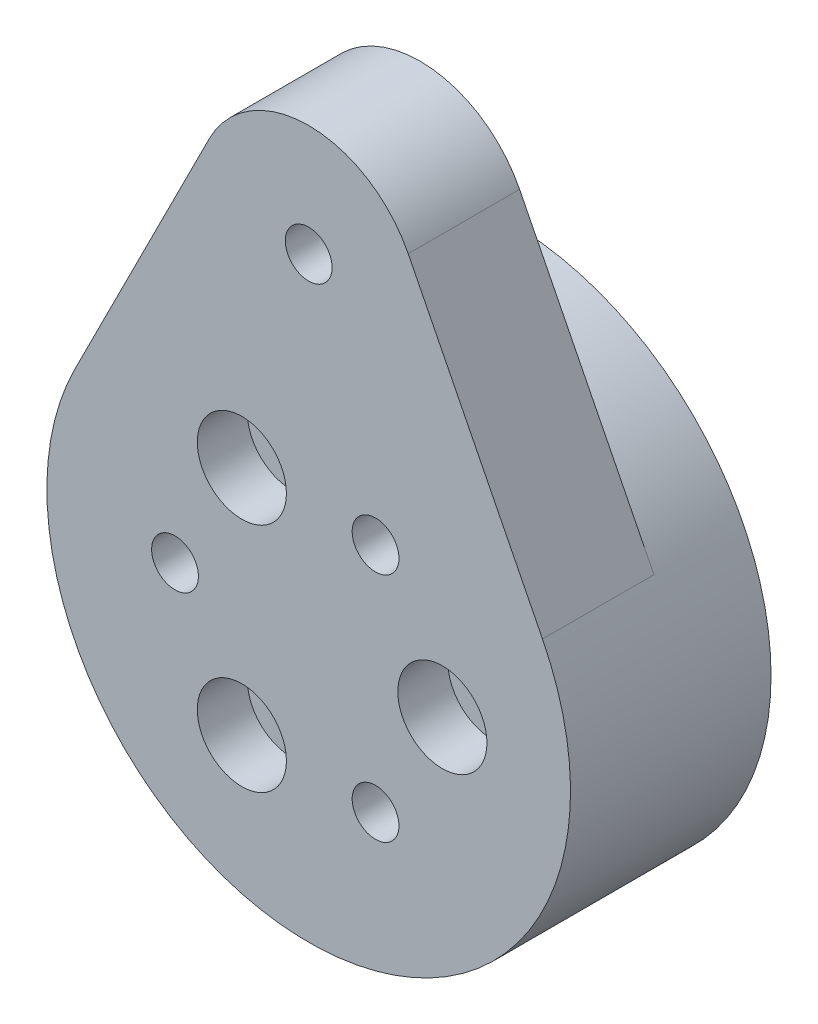
from build123d import *

# Parameters (mm, degrees)
SKETCH1_R           = 23.5
BOSS_EXTRUDE1_DEPTH = 18
BOSS_EXTRUDE2_START = -10
BOSS_EXTRUDE2_DEPTH = 10
SKETCH8_R           = 2.25
CUT_EXTRUDE3_DEPTH  = 50.761933242
SKETCH9_R           = 4
CUT_EXTRUDE4_DEPTH  = 4.5
SKETCH10_R          = 2.1
CUT_EXTRUDE5_DEPTH  = 5.7


with BuildPart() as part:
    # Sketch1 → Boss-Extrude1 (new body)
    with BuildSketch(Plane.XY):
        Circle(SKETCH1_R)
    extrude(amount=BOSS_EXTRUDE1_DEPTH)

    # Sketch7 → Boss-Extrude2 (add)
    with BuildSketch(Plane.XY.offset(18).offset(BOSS_EXTRUDE2_START)):
        with BuildLine():
            ThreePointArc((0, 23.5), (12.323503966, 20.00952898), (20.986171042, 10.575))
            Line((20.986171042, 10.575), (8.93028555, 34.5))
            ThreePointArc((8.93028555, 34.5), (0, 40), (-8.93028555, 34.5))
            Line((-8.93028555, 34.5), (-20.986171042, 10.575))
            ThreePointArc((-20.986171042, 10.575), (-12.323503966, 20.00952898), (0, 23.5))
        make_face()
    extrude(amount=BOSS_EXTRUDE2_DEPTH)

    # Sketch8 → Cut-Extrude3 (cut, through all)
    with BuildSketch(Plane.XY.offset(18)):
        with Locations((12, 0)):
            Circle(SKETCH8_R)
        with Locations((-6, -10.392304845)):
            Circle(SKETCH8_R)
        with Locations((-6, 10.392304845)):
            Circle(SKETCH8_R)
    extrude(amount=-CUT_EXTRUDE3_DEPTH, mode=Mode.SUBTRACT)

    # Sketch9 → Cut-Extrude4 (cut)
    with BuildSketch(Plane.XY.offset(18)):
        with Locations((-6, 10.392304845)):
            Circle(SKETCH9_R)
        with Locations((12, 0)):
            Circle(SKETCH9_R)
        with Locations((-6, -10.392304845)):
            Circle(SKETCH9_R)
    extrude(amount=-CUT_EXTRUDE4_DEPTH, mode=Mode.SUBTRACT)

    # Sketch10 → Cut-Extrude5 (cut)
    with BuildSketch(Plane.XY.offset(18)):
        with Locations((0, 30)):
            Circle(SKETCH10_R)
        with Locations((12, 0)):
            Circle(SKETCH10_R)
        with Locations((6, -10.392304845)):
            Circle(SKETCH10_R)
        with Locations((-6, -10.392304845)):
            Circle(SKETCH10_R)
        with Locations((-12, 0)):
            Circle(SKETCH10_R)
        with Locations((-6, 10.392304845)):
            Circle(SKETCH10_R)
        with Locations((6, 10.392304845)):
            Circle(SKETCH10_R)
    extrude(amount=-CUT_EXTRUDE5_DEPTH, mode=Mode.SUBTRACT)


solid = part.part
